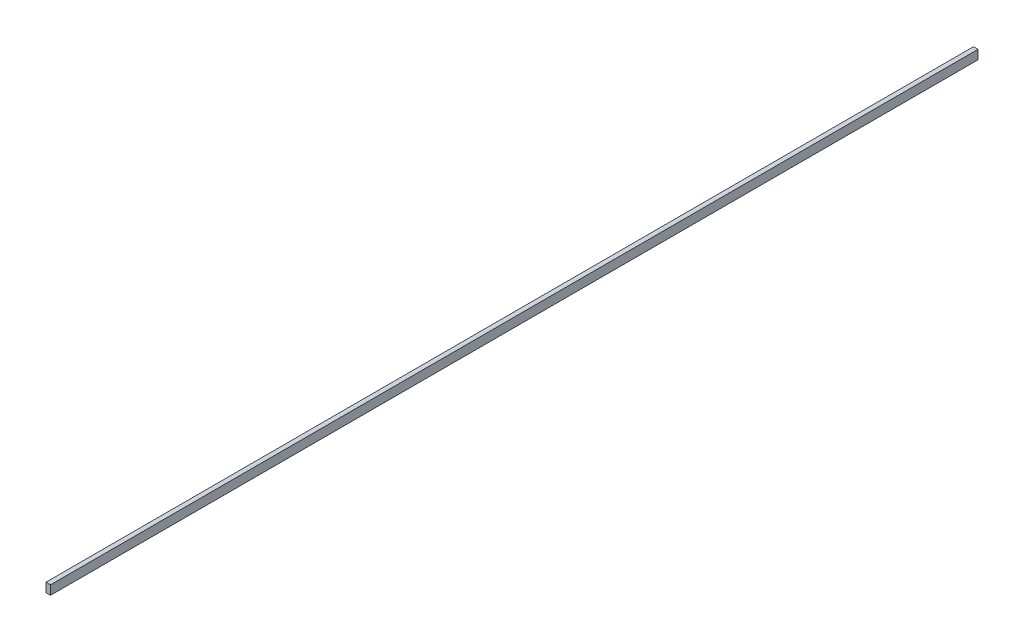
from build123d import *

# Parameters (mm, degrees)
BOSS_EXTRUDE1_DEPTH = 1020


with BuildPart() as part:
    # Sketch1 → Boss-Extrude1 (new body)
    with BuildSketch(Plane.XY):
        Polygon((0, 10), (0, 0), (5, 0), (5, 5), (5, 10), align=None)
    extrude(amount=BOSS_EXTRUDE1_DEPTH)


solid = part.part
